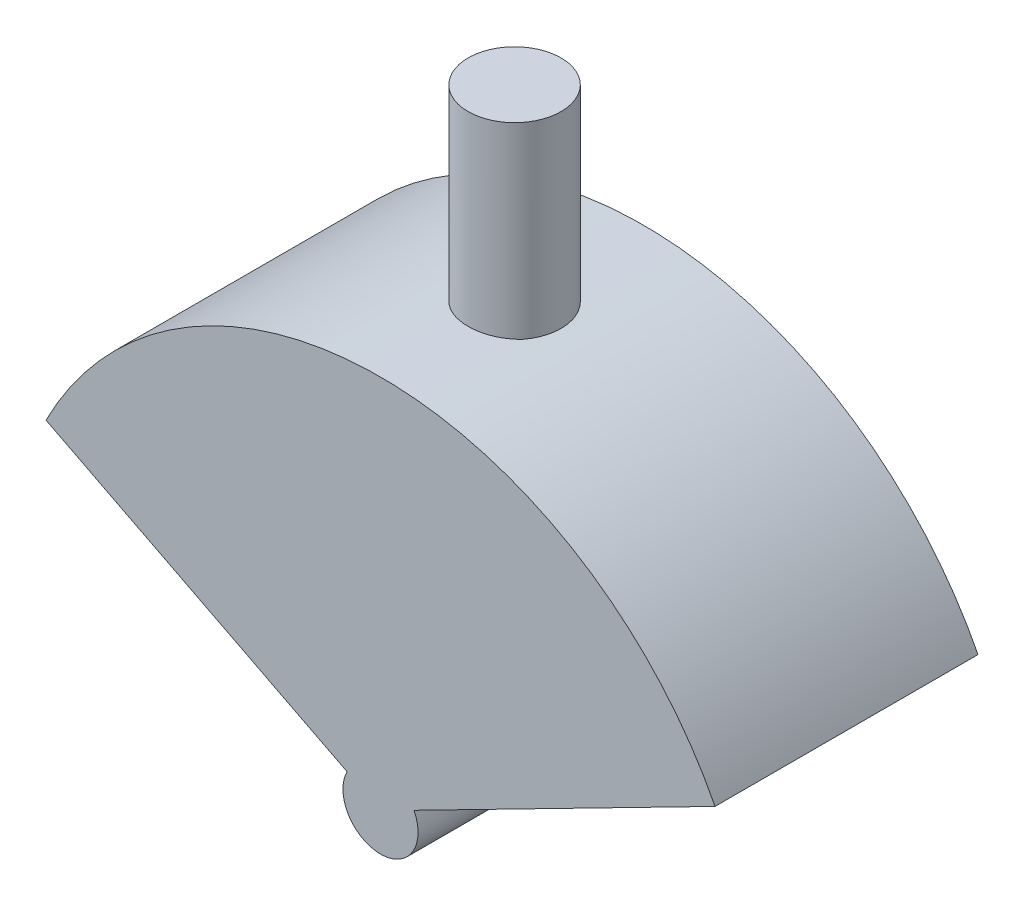
from build123d import *

# Parameters (mm, degrees)
BOSS_EXTRUDE1_DEPTH = 35
SHELL1_T            = -2
SKETCH3_R           = 5
BOSS_EXTRUDE2_DEPTH = 35
SKETCH4_R           = 6.188496774
BOSS_EXTRUDE3_DEPTH = 25


with BuildPart() as part:
    # Sketch2 → Boss-Extrude1 (new body)
    with BuildSketch(Plane.XY):
        with BuildLine():
            Line((0, 0), (-44.5203539, 22.758253198))
            ThreePointArc((-44.5203539, 22.758253198), (0, 50), (44.5203539, 22.758253198))
            Line((44.5203539, 22.758253198), (0, 0))
        make_face()
    extrude(amount=BOSS_EXTRUDE1_DEPTH)

    # Shell1
    shell1_openings = [part.faces().sort_by_distance(p)[0] for p in [
        (-22.26017695, 11.379126599, 17.5),
        (22.26017695, 11.379126599, 17.5),
    ]]
    offset(amount=SHELL1_T, openings=shell1_openings, kind=Kind.INTERSECTION)

    # Sketch3 → Boss-Extrude2 (add)
    with BuildSketch(Plane.XY.offset(35)):
        with Locations(Location((0, 0, 0), (0, 0, 27.075555237))):
            Circle(SKETCH3_R)
    extrude(amount=-BOSS_EXTRUDE2_DEPTH)

    # Sketch4 → Boss-Extrude3 (add)
    with BuildSketch(Plane(origin=(0, 49.758126055, 0), x_dir=(1, 0, 0), z_dir=(0, 1, 0))):
        with Locations(Location((0, -17.15723549, 0), (0, 0, 142.53731078))):
            Circle(SKETCH4_R)
    extrude(amount=BOSS_EXTRUDE3_DEPTH)


solid = part.part
